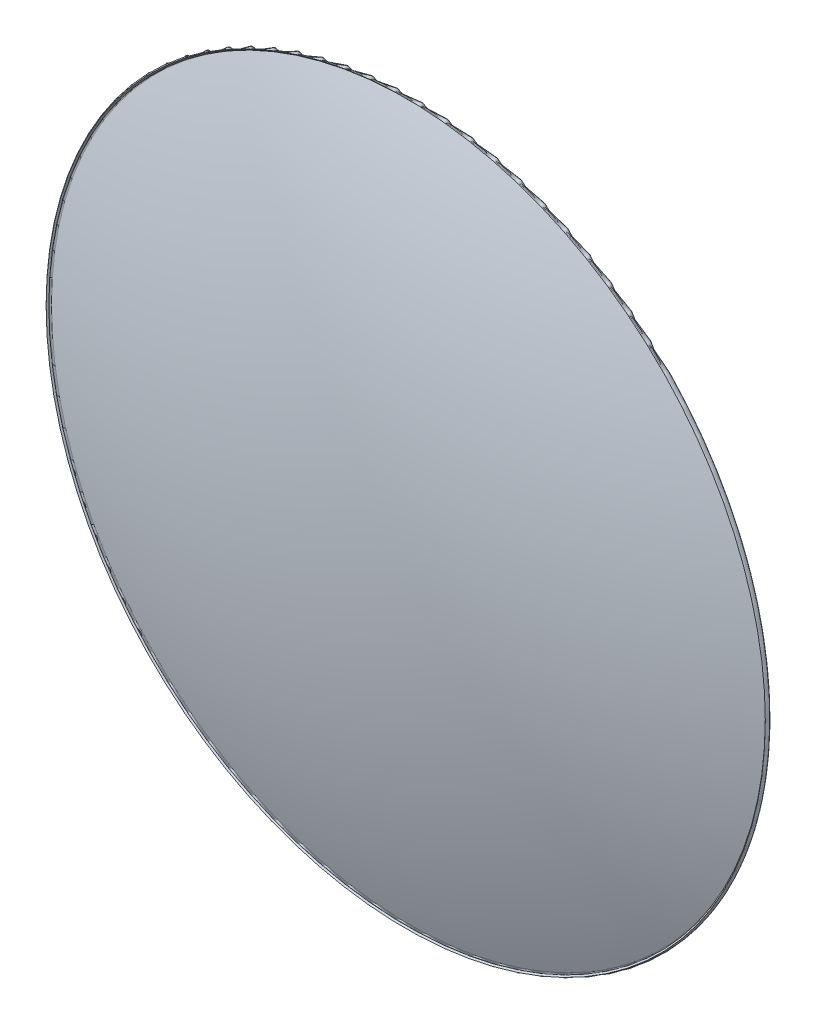
from build123d import *


with BuildPart() as part:
    # Sketch1 → Revolve1 (revolve)
    with BuildSketch(Plane(origin=(0, 0, 0), x_dir=(0, 0, -1), z_dir=(1, 0, 0))):
        with BuildLine():
            Line((-1011.18703859, -383.499794664), (-1012.622562524, -384.976006773))
            ThreePointArc((-1012.622562524, -384.976006773), (-1008.686470293, -385.774613024), (-1007.314285714, -382))
            ThreePointArc((-1007.314285714, -382), (-1059.669793003, -194.180328561), (-1077.314285714, 0))
            Line((-1077.314285714, 0), (-1079.314285714, 0))
            ThreePointArc((-1079.314285714, 0), (-1061.637036559, -194.540818218), (-1009.184332922, -382.709170954))
            ThreePointArc((-1009.184332922, -382.709170954), (-1009.795684925, -384.092382446), (-1011.18703859, -383.499794664))
        make_face()
    revolve(axis=Axis((0, 0, 1077.314285714), (0, 0, 1)))


solid = part.part
